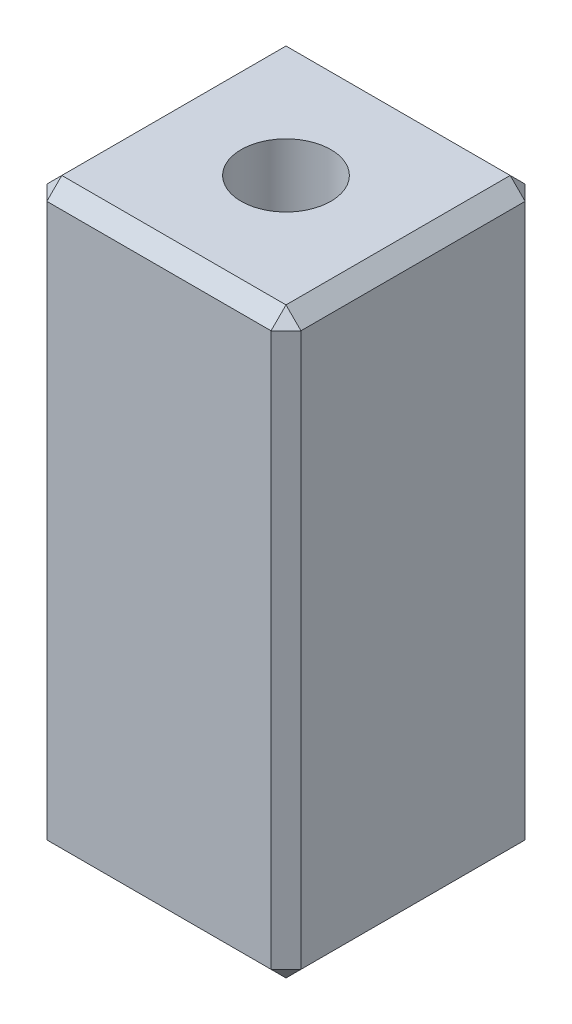
from build123d import *

# Parameters (mm, degrees)
SKETCH1_W           = 8.5
SKETCH1_H           = 8.5
SKETCH1_R           = 1.5
BOSS_EXTRUDE1_DEPTH = 19.5
CHAMFER1_SIZE       = 0.5


with BuildPart() as part:
    # Sketch1 → Boss-Extrude1 (new body)
    with BuildSketch(Plane(origin=(0, 0, 0), x_dir=(1, 0, 0), z_dir=(0, 1, 0))):
        Rectangle(SKETCH1_W, SKETCH1_H)
        with Locations(Location((0, 0, 0), (0, 0, 270))):
            Circle(SKETCH1_R, mode=Mode.SUBTRACT)
    extrude(amount=BOSS_EXTRUDE1_DEPTH)

    # Chamfer1
    chamfer1_edges = [part.edges().sort_by_distance(p)[0] for p in [
        (-4.25, 19.5, 0),
        (0, 19.5, 4.25),
        (4.25, 19.5, 0),
        (0, 0, 4.25),
        (-4.25, 0, 0),
        (0, 0, -4.25),
        (4.25, 0, 0),
        (4.25, 9.75, 4.25),
        (-4.25, 9.75, 4.25),
        (-4.25, 9.75, -4.25),
        (4.25, 9.75, -4.25),
        (0, 19.5, -4.25),
    ]]
    chamfer(chamfer1_edges, length=CHAMFER1_SIZE)


solid = part.part
